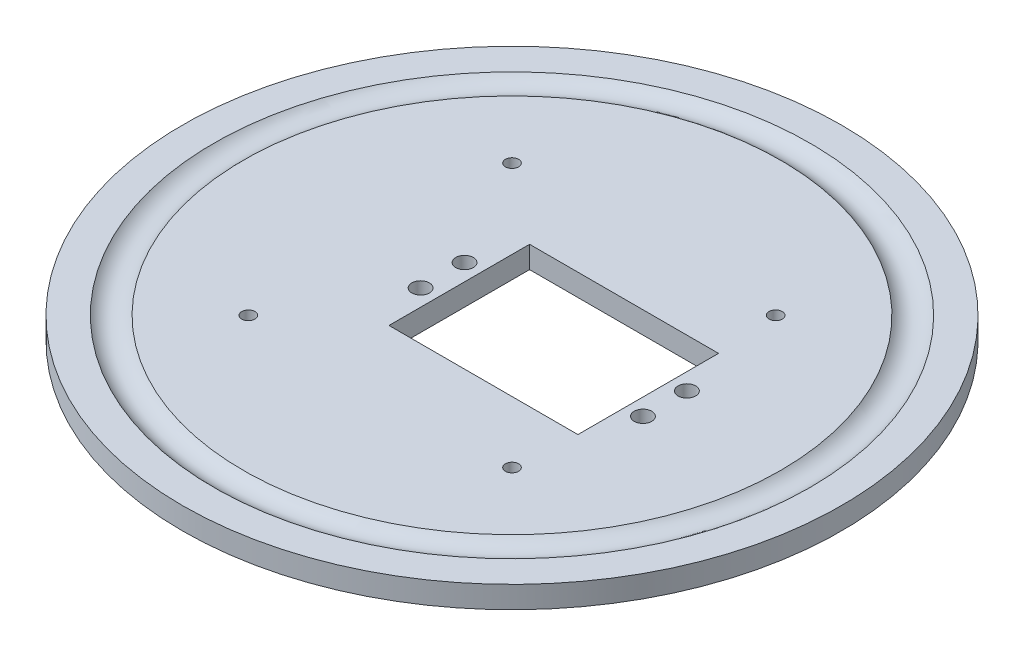
from build123d import *

# Parameters (mm, degrees)
CROQUIS1_R              = 75
SALIENTE_EXTRUIR1_DEPTH = 5
CORTAR_EXTRUIR1_DEPTH   = 5
CORTAR_EXTRUIR2_DEPTH   = 5
CROQUIS6_R              = 4.5
CROQUIS11_W             = 43
CROQUIS11_H             = 3
CORTAR_EXTRUIR3_DEPTH   = 5
CROQUIS12_R             = 2
CORTAR_EXTRUIR4_DEPTH   = 5


with BuildPart() as part:
    # Croquis1 → Saliente-Extruir1 (new body)
    with BuildSketch(Plane(origin=(0, 0, 0), x_dir=(1, 0, 0), z_dir=(0, 1, 0))):
        with Locations(Location((0, 0, 0), (0, 0, 270))):
            Circle(CROQUIS1_R)
    extrude(amount=SALIENTE_EXTRUIR1_DEPTH)

    # Croquis2 → Cortar-Extruir1 (cut)
    with BuildSketch(Plane(origin=(0, 5, 0), x_dir=(1, 0, 0), z_dir=(0, 1, 0))):
        Polygon((31, 0), (0, 0), (-12, 0), (-12, -13), (31, -13), align=None)
        Polygon((-12, 0), (0, 0), (31, 0), (31, 13), (-12, 13), align=None)
    extrude(amount=-CORTAR_EXTRUIR1_DEPTH, mode=Mode.SUBTRACT)

    # Croquis4 → Cortar-Extruir2 (cut)
    with BuildSketch(Plane(origin=(0, 5, 0), x_dir=(1, 0, 0), z_dir=(0, 1, 0))):
        with BuildLine():
            ThreePointArc((-28.5, 30), (-31.060660172, 31.060660172), (-30, 28.5))
            Line((-30, 28.5), (-30, 30))
            Line((-30, 30), (-28.5, 30))
        make_face()
        with BuildLine():
            Line((-30, 30), (-30, 28.5))
            ThreePointArc((-30, 28.5), (-28.939339828, 28.939339828), (-28.5, 30))
            Line((-28.5, 30), (-30, 30))
        make_face()
        with BuildLine():
            ThreePointArc((28.5, 30), (28.939339828, 28.939339828), (30, 28.5))
            Line((30, 28.5), (30, 30))
            Line((30, 30), (28.5, 30))
        make_face()
        with BuildLine():
            Line((30, 30), (30, 28.5))
            ThreePointArc((30, 28.5), (31.060660172, 28.939339828), (31.5, 30))
            ThreePointArc((31.5, 30), (30, 31.5), (28.5, 30))
            Line((28.5, 30), (30, 30))
        make_face()
        with BuildLine():
            ThreePointArc((30, -28.5), (28.939339828, -28.939339828), (28.5, -30))
            Line((28.5, -30), (30, -30))
            Line((30, -30), (30, -28.5))
        make_face()
        with BuildLine():
            Line((30, -30), (28.5, -30))
            ThreePointArc((28.5, -30), (30, -31.5), (31.5, -30))
            ThreePointArc((31.5, -30), (31.060660172, -28.939339828), (30, -28.5))
            Line((30, -28.5), (30, -30))
        make_face()
        with BuildLine():
            Line((-30, -28.5), (-30, -30))
            Line((-30, -30), (-28.5, -30))
            ThreePointArc((-28.5, -30), (-28.939339828, -28.939339828), (-30, -28.5))
        make_face()
        with BuildLine():
            Line((-28.5, -30), (-30, -30))
            Line((-30, -30), (-30, -28.5))
            ThreePointArc((-30, -28.5), (-31.060660172, -31.060660172), (-28.5, -30))
        make_face()
    extrude(amount=-CORTAR_EXTRUIR2_DEPTH, mode=Mode.SUBTRACT)

    # Cortar-Barrer3: sweep along a path in Croquis5
    with BuildLine(Plane(origin=(0, 5, 0), x_dir=(1, 0, 0), z_dir=(0, 1, 0))) as cortar_barrer3_path:
        CenterArc((0, 0), 64.5, 0, 360)
    # Croquis6 → Cortar-Barrer3 (sweep, cut)
    with BuildSketch(Plane.XY):
        with Locations((64.5, 8)):
            Circle(CROQUIS6_R)
    sweep(path=cortar_barrer3_path.line, mode=Mode.SUBTRACT)

    # Croquis11 → Cortar-Extruir3 (cut)
    with BuildSketch(Plane(origin=(0, 5, 0), x_dir=(1, 0, 0), z_dir=(0, 1, 0))):
        with Locations((9.5, 14.5)):
            Rectangle(CROQUIS11_W, CROQUIS11_H)
        with Locations((9.5, -14.5)):
            Rectangle(CROQUIS11_W, CROQUIS11_H)
    extrude(amount=-CORTAR_EXTRUIR3_DEPTH, mode=Mode.SUBTRACT)

    # Croquis12 → Cortar-Extruir4 (cut)
    with BuildSketch(Plane(origin=(0, 5, 0), x_dir=(1, 0, 0), z_dir=(0, 1, 0))):
        with Locations(Location((34.8, 5, 0), (0, 0, 270))):
            Circle(CROQUIS12_R)
        with Locations(Location((34.8, -5, 0), (0, 0, 270))):
            Circle(CROQUIS12_R)
        with Locations(Location((-15.8, -5, 0), (0, 0, 270))):
            Circle(CROQUIS12_R)
        with Locations(Location((-15.8, 5, 0), (0, 0, 270))):
            Circle(CROQUIS12_R)
    extrude(amount=-CORTAR_EXTRUIR4_DEPTH, mode=Mode.SUBTRACT)


solid = part.part
